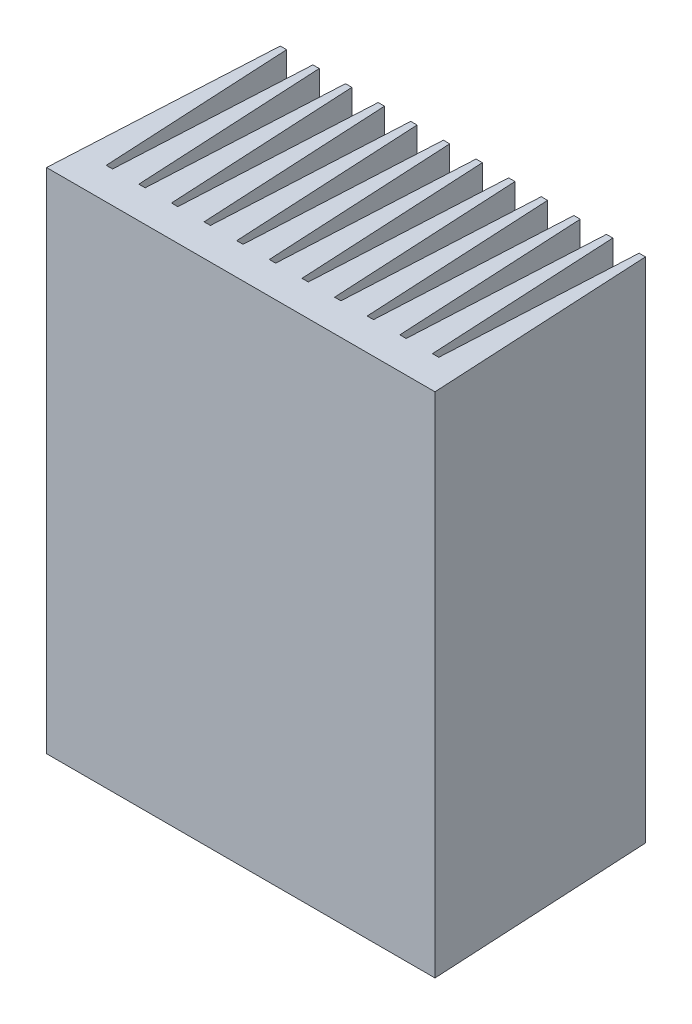
from build123d import *

# Parameters (mm, degrees)
BOSS_EXTRUDE1_DEPTH = 80


with BuildPart() as part:
    # Sketch1 → Boss-Extrude1 (new body)
    with BuildSketch(Plane(origin=(0, 0, 0), x_dir=(1, 0, 0), z_dir=(0, 1, 0))):
        Polygon((0, 5), (0, 0), (30.606505653, 0), (30.344466757, 5), (28.772233378, 35), (27.772233378, 35), (26.2, 5), (25.704466757, 5), (25.7, 5), (25.204466757, 5), (23.632233378, 35), (22.632233378, 35), (21.06, 5), (20.564466757, 5), (20.56, 5), (20.064466757, 5), (18.492233378, 35), (17.492233378, 35), (15.92, 5), (15.424466757, 5), (15.42, 5), (14.924466757, 5), (13.352233378, 35), (12.352233378, 35), (10.78, 5), (10.284466757, 5), (10.28, 5), (9.784466757, 5), (8.212233378, 35), (7.212233378, 35), (5.64, 5), (5.144466757, 5), (5.14, 5), (4.644466757, 5), (3.072233378, 35), (2.072233378, 35), (0.5, 5), align=None)
    boss_extrude1 = extrude(amount=-BOSS_EXTRUDE1_DEPTH)

    # Mirror1: Boss-Extrude1 across plane
    add(boss_extrude1.mirror(Plane(origin=(0, -80, 0), x_dir=(0, 0, 1), z_dir=(1, 0, 0))))


solid = part.part
